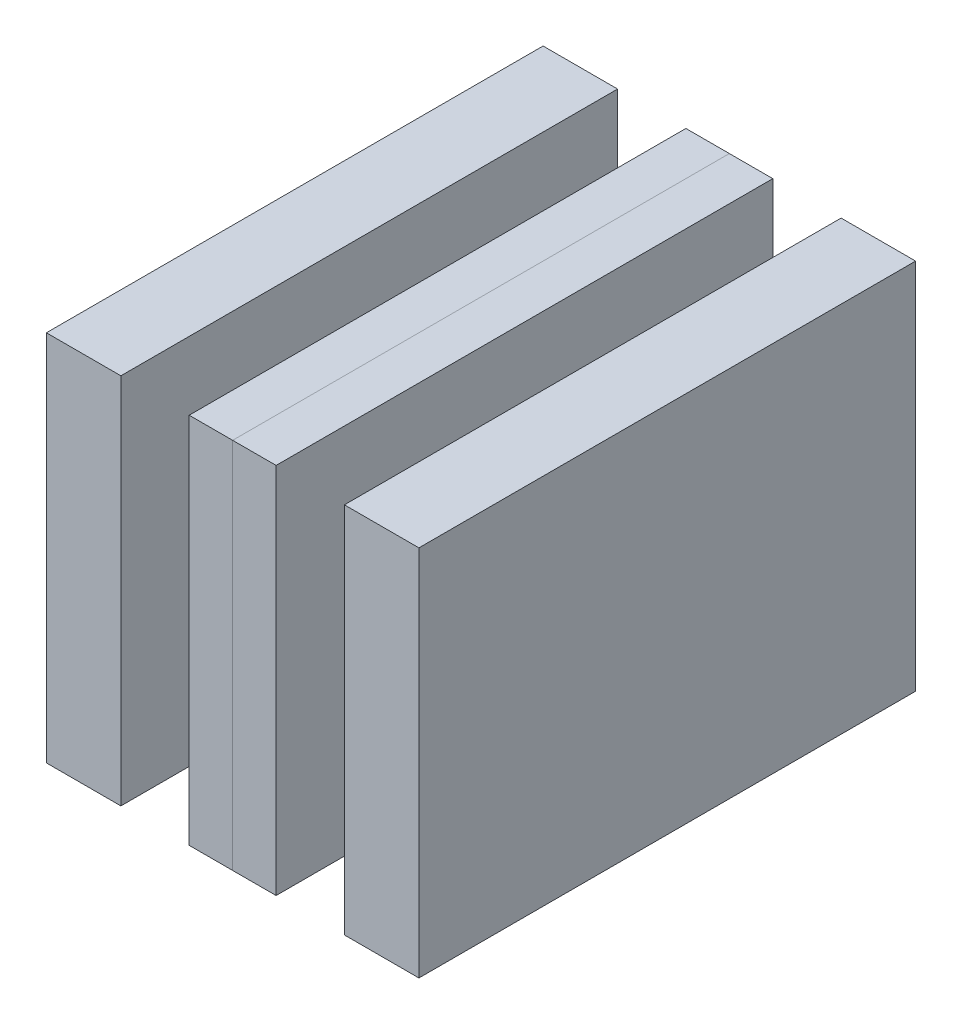
from build123d import *

# Parameters (mm, degrees)
SKETCH1_W             = 3
SKETCH1_H             = 15
BOSS_EXTRUDE1_DEPTH   = 20
SKETCH1_W_2           = 1.75
BOSS_EXTRUDE1_2_DEPTH = 20


with BuildPart() as part:
    # Sketch1 → Boss-Extrude1 (new body)
    with BuildSketch(Plane.XY):
        with Locations((1.5, 7.5)):
            Rectangle(SKETCH1_W, SKETCH1_H)
    extrude(amount=BOSS_EXTRUDE1_DEPTH)


with BuildPart() as body_2:
    # Sketch1 → Boss-Extrude1 2 (new body)
    with BuildSketch(Plane.XY):
        with Locations((6.625, 7.5)):
            Rectangle(SKETCH1_W_2, SKETCH1_H)
    extrude(amount=BOSS_EXTRUDE1_2_DEPTH)


with BuildPart() as body_3:
    # Mirror1: mirrored copy
    add(body_2.part.mirror(Plane(origin=(7.5, 15, 20), x_dir=(0, 0, 1), z_dir=(-1, 0, 0))))


with BuildPart() as body_4:
    # Mirror1 2: mirrored copy
    add(part.part.mirror(Plane(origin=(7.5, 15, 20), x_dir=(0, 0, 1), z_dir=(-1, 0, 0))))


solid = Compound([part.part, body_2.part, body_3.part, body_4.part])
